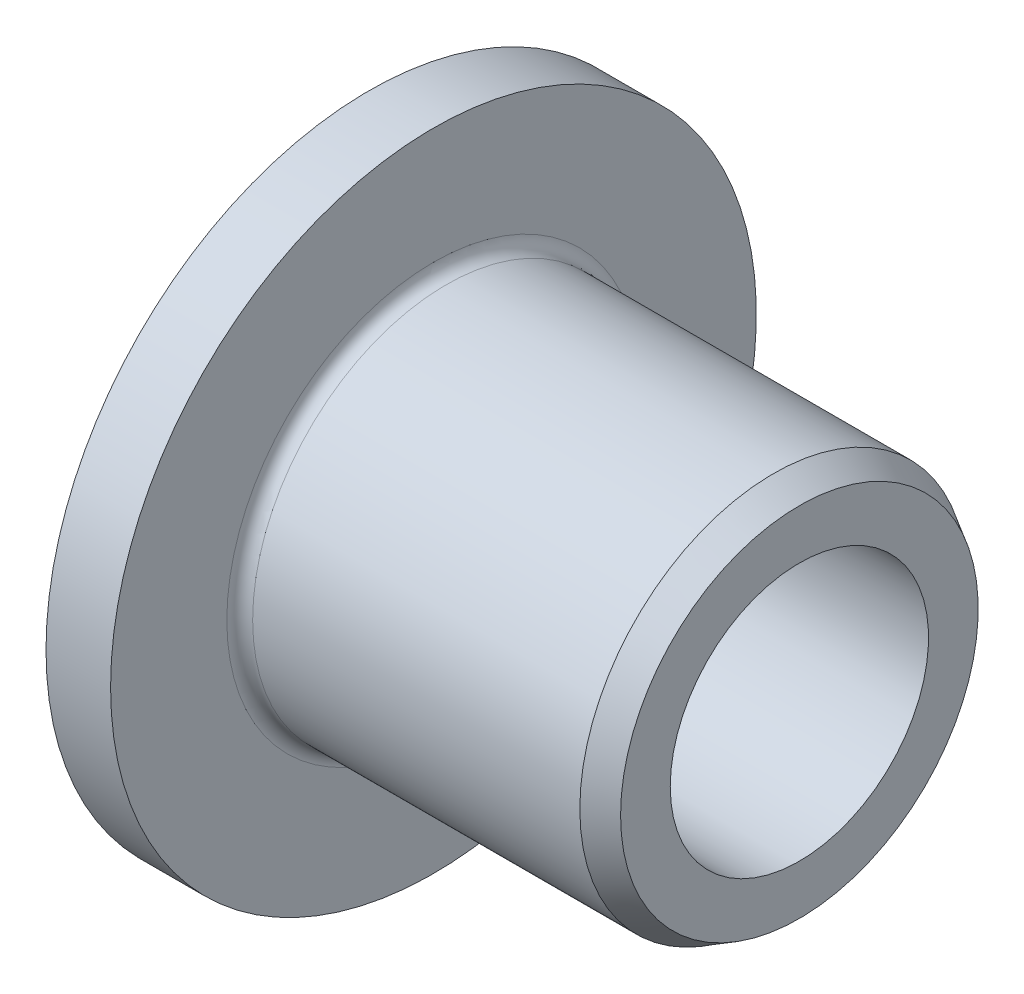
from build123d import *


with BuildPart() as part:
    # Sketch3 → Revolve1 (revolve)
    with BuildSketch(Plane.XY, mode=Mode.PRIVATE) as revolve1_sk:
        with BuildLine():
            Line((-1.6, 2.25), (2.2, 2.25))
            Line((2.2, 2.25), (2.5, 2.076794919))
            Line((2.5, 2.076794919), (2.5, 1.5))
            Line((2.5, 1.5), (-2.5, 1.5))
            Line((-2.5, 1.5), (-2.5, 3.75))
            Line((-2.5, 3.75), (-1.75, 3.75))
            Line((-1.75, 3.75), (-1.75, 2.4))
            ThreePointArc((-1.75, 2.4), (-1.706066017, 2.293933983), (-1.6, 2.25))
        make_face()
    revolve(revolve1_sk.sketch.rotate(Axis((-2.5, 0, 0), (1, 0, 0)), 90), axis=Axis((-2.5, 0, 0), (1, 0, 0)))


solid = part.part
